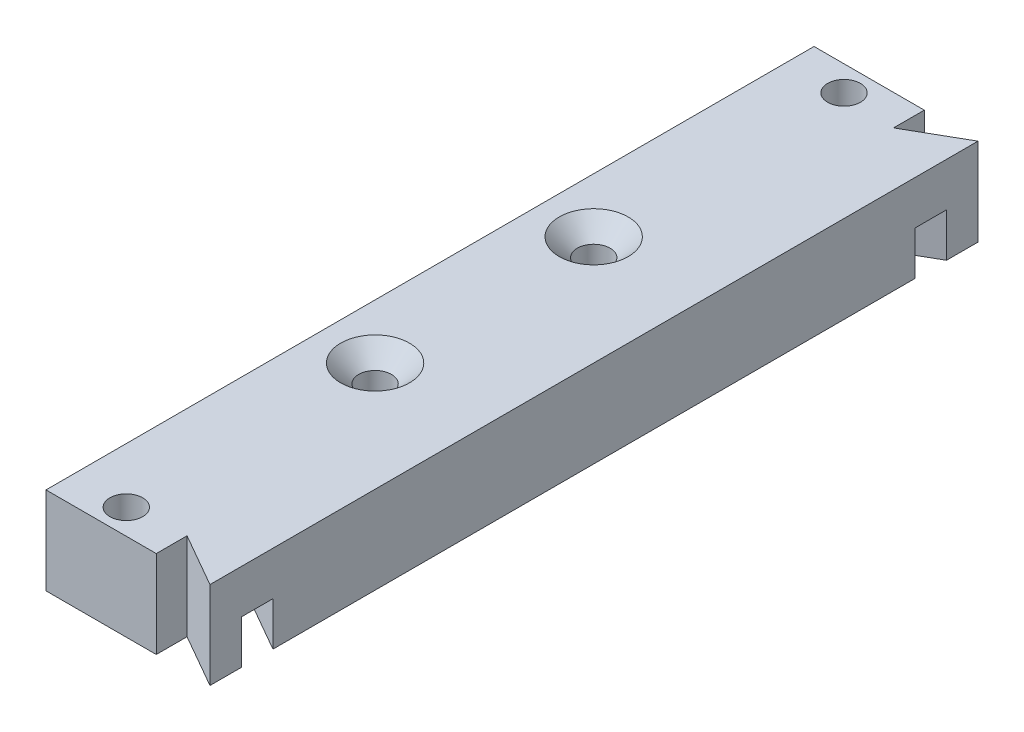
from build123d import *

# Parameters (mm, degrees)
SKETCH1_W                     = 15
SKETCH1_H                     = 49
BOSS_EXTRUDE1_DEPTH           = 8
CSK_FOR_M3_SFHCS1_D           = 3
CSK_FOR_M3_SFHCS1_CSINK_D     = 6.3
CSK_FOR_M3_SFHCS1_CSINK_ANGLE = 90
BOSS_EXTRUDE2_DEPTH           = 8
BOSS_EXTRUDE3_DEPTH           = 4
BOSS_EXTRUDE4_DEPTH           = 8
SKETCH8_W                     = 10.087191575
SKETCH8_H                     = 5.631262012
BOSS_EXTRUDE5_DEPTH           = 8
CUT_EXTRUDE1_START            = -8
SKETCH9_R                     = 1.5
CUT_EXTRUDE1_DEPTH            = 8


with BuildPart() as part:
    # Sketch1 → Boss-Extrude1 (new body)
    with BuildSketch(Plane(origin=(0, 0, 0), x_dir=(1, 0, 0), z_dir=(0, 1, 0))):
        Rectangle(SKETCH1_W, SKETCH1_H)
    extrude(amount=BOSS_EXTRUDE1_DEPTH)

    # CSK for M3 SFHCS1 (through all)
    with Locations(Plane(origin=(0, 8, 0), x_dir=(1, 0, 0), z_dir=(0, 1, 0))):
        with Locations((-2.499999911, -10.025), (-2.499999911, 9.975)):
            CounterSinkHole(CSK_FOR_M3_SFHCS1_D / 2, CSK_FOR_M3_SFHCS1_CSINK_D / 2, counter_sink_angle=CSK_FOR_M3_SFHCS1_CSINK_ANGLE)

    # Sketch5 → Boss-Extrude2 (add)
    with BuildSketch(Plane(origin=(0, 8, 0), x_dir=(1, 0, 0), z_dir=(0, 1, 0))):
        Polygon((-0.994383151, -24.5), (7.5, -29.368304747), (7.5, -24.5), align=None)
        Polygon((-0.994383151, 24.5), (7.5, 24.5), (7.5, 29.368304747), align=None)
    extrude(amount=-BOSS_EXTRUDE2_DEPTH)

    # Sketch6 → Boss-Extrude3 (add)
    with BuildSketch(Plane(origin=(0, 8, 0), x_dir=(1, 0, 0), z_dir=(0, 1, 0))):
        Polygon((7.5, 29.368304747), (-0.994383151, 24.5), (-7.5, 24.5), (-7.5, 27), (-1.66, 27), (6.256887241, 31.537330028), (7.5, 32.249783379), align=None)
        Polygon((-7.5, -24.5), (-0.994383151, -24.5), (7.5, -29.368304747), (7.5, -32.249783379), (6.256887241, -31.537330028), (-1.66, -27), (-7.5, -27), align=None)
    extrude(amount=-BOSS_EXTRUDE3_DEPTH)

    # Sketch7 → Boss-Extrude4 (add)
    with BuildSketch(Plane(origin=(0, 8, 0), x_dir=(1, 0, 0), z_dir=(0, 1, 0))):
        Polygon((-1.66, -27), (7.5, -32.249783379), (7.5, -35.131262012), (6.256887241, -34.41880866), (-2.325616849, -29.5), (-7.5, -29.5), (-7.5, -27), align=None)
        Polygon((7.5, 32.249783379), (-1.66, 27), (-7.5, 27), (-7.5, 29.5), (-2.325616849, 29.5), (6.256887241, 34.41880866), (7.5, 35.131262012), align=None)
    extrude(amount=-BOSS_EXTRUDE4_DEPTH)

    # Sketch8 → Boss-Extrude5 (add)
    with BuildSketch(Plane(origin=(0, 8, 0), x_dir=(1, 0, 0), z_dir=(0, 1, 0))):
        with Locations((-2.456404213, -32.315631006)):
            Rectangle(SKETCH8_W, SKETCH8_H)
        with Locations((-2.456404213, 32.315631006)):
            Rectangle(SKETCH8_W, SKETCH8_H)
    extrude(amount=-BOSS_EXTRUDE5_DEPTH)

    # Sketch9 → Cut-Extrude1 (cut)
    with BuildSketch(Plane(origin=(0, 8, 0), x_dir=(1, 0, 0), z_dir=(0, 1, 0)).offset(CUT_EXTRUDE1_START)):
        with Locations(Location((-2.456404212, 32.831262012, 0), (0, 0, 270))):
            Circle(SKETCH9_R)
        with Locations(Location((-2.456404212, -32.831262012, 0), (0, 0, 270))):
            Circle(SKETCH9_R)
    extrude(amount=CUT_EXTRUDE1_DEPTH, mode=Mode.SUBTRACT)


solid = part.part
